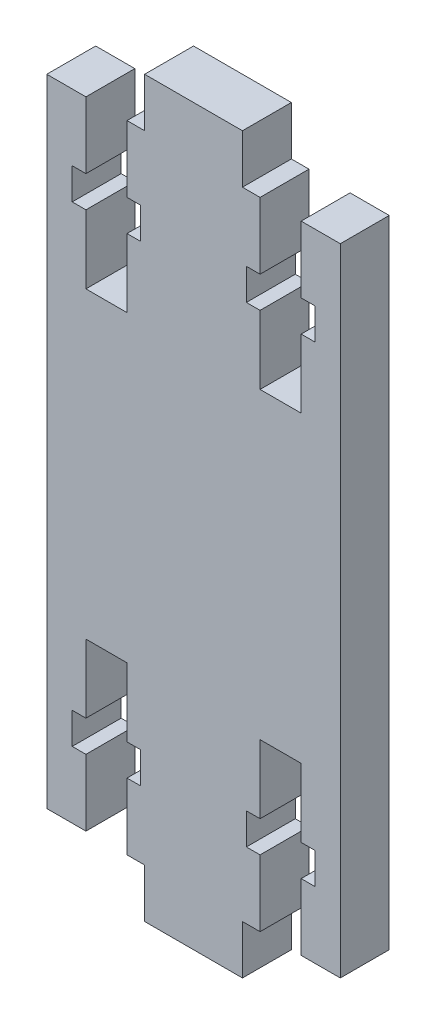
from build123d import *

# Parameters (mm, degrees)
BOSS_EXTRUDE1_DEPTH = 5


with BuildPart() as part:
    # Sketch1 → Boss-Extrude1 (new body)
    with BuildSketch(Plane.XY):
        Polygon((-4, 0), (0, 0), (0, 65), (-4, 65), (-4, 58.2), (-2.6, 58.2), (-2.6, 55), (-4, 55), (-4, 48), (-8.2, 48), (-8.2, 55), (-9.6, 55), (-9.6, 58.2), (-8.2, 58.2), (-8.2, 65), (-10, 65), (-10, 70), (-20, 70), (-20, 65), (-21.8, 65), (-21.8, 58.2), (-20.4, 58.2), (-20.4, 55), (-21.8, 55), (-21.8, 48), (-26, 48), (-26, 55), (-27.4, 55), (-27.4, 58.2), (-26, 58.2), (-26, 65), (-30, 65), (-30, 0), (-26, 0), (-26, 6.8), (-27.4, 6.8), (-27.4, 10), (-26, 10), (-26, 17), (-21.8, 17), (-21.8, 10), (-20.4, 10), (-20.4, 6.8), (-21.8, 6.8), (-21.8, 0), (-20, 0), (-20, -5), (-10, -5), (-10, 0), (-8.2, 0), (-8.2, 6.8), (-9.6, 6.8), (-9.6, 10), (-8.2, 10), (-8.2, 17), (-4, 17), (-4, 10), (-2.6, 10), (-2.6, 6.8), (-4, 6.8), align=None)
    extrude(amount=BOSS_EXTRUDE1_DEPTH)


solid = part.part
